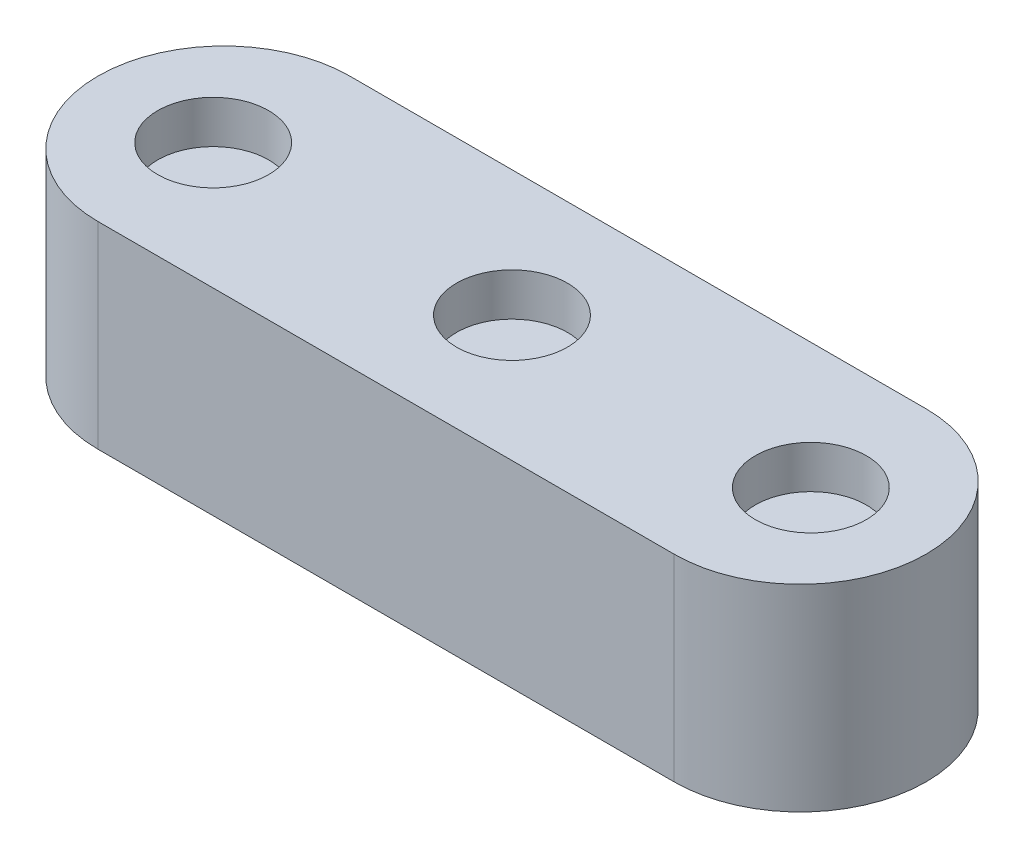
from build123d import *

# Parameters (mm, degrees)
BOSS_EXTRUDE1_DEPTH = 23.1
SKETCH2_R           = 6.5
CUT_EXTRUDE1_DEPTH  = 5


with BuildPart() as part:
    # Sketch1 → Boss-Extrude1 (new body)
    with BuildSketch(Plane(origin=(0, 0, 0), x_dir=(1, 0, 0), z_dir=(0, 1, 0))):
        with BuildLine():
            ThreePointArc((33.75, 14.75), (48.5, 0), (33.75, -14.75))
            Line((33.75, -14.75), (-33.75, -14.75))
            ThreePointArc((-33.75, -14.75), (-48.5, 0), (-33.75, 14.75))
            Line((-33.75, 14.75), (33.75, 14.75))
        make_face()
    extrude(amount=BOSS_EXTRUDE1_DEPTH)

    # Sketch2 → Cut-Extrude1 (cut)
    with BuildSketch(Plane(origin=(0, 23.1, 0), x_dir=(1, 0, 0), z_dir=(0, 1, 0))):
        with Locations(Location((0, 0, 0), (0, 0, 270))):
            Circle(SKETCH2_R)
        with Locations(Location((-35, 0, 0), (0, 0, 270))):
            Circle(SKETCH2_R)
        with Locations(Location((35, 0, 0), (0, 0, 270))):
            Circle(SKETCH2_R)
    extrude(amount=-CUT_EXTRUDE1_DEPTH, mode=Mode.SUBTRACT)


solid = part.part
